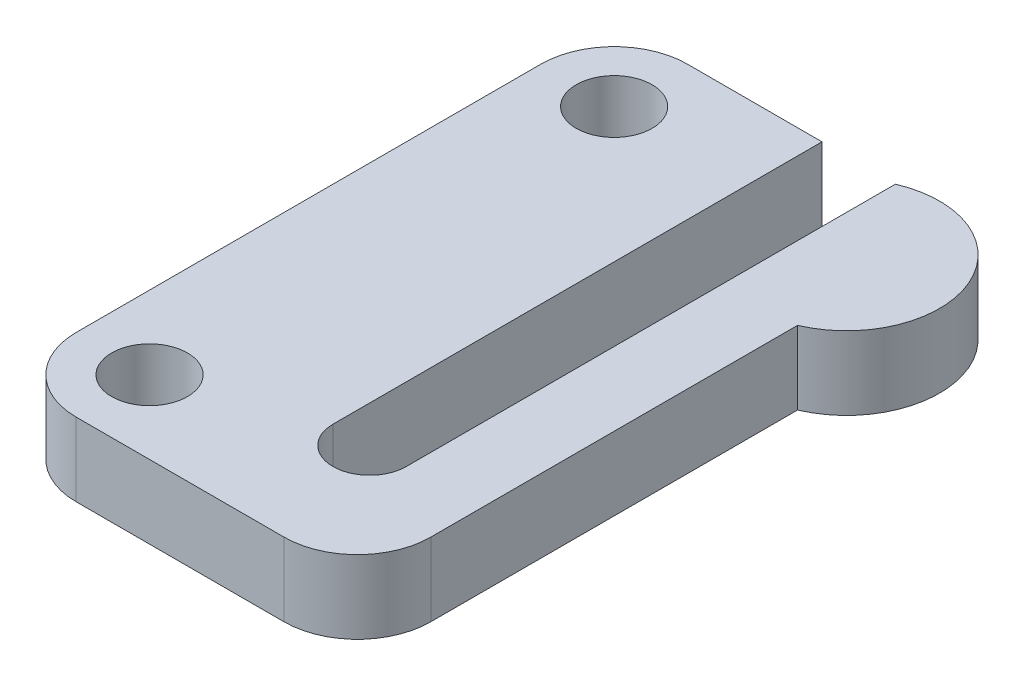
from build123d import *

# Parameters (mm, degrees)
SKETCH1_R           = 1.55
BOSS_EXTRUDE1_DEPTH = 3
FILLET1_R           = 3
FILLET3_R           = 3


with BuildPart() as part:
    # Sketch1 → Boss-Extrude1 (new body)
    with BuildSketch(Plane(origin=(0, 0, 0), x_dir=(1, 0, 0), z_dir=(0, 1, 0))):
        with BuildLine():
            Line((2, -7.5), (2, 5.5))
            ThreePointArc((2, 5.5), (4, 10.5), (-1, 12.5))
            Line((-1, 12.5), (-1, -7.5))
            ThreePointArc((-1, -7.5), (-2.5, -9), (-4, -7.5))
            Line((-4, -7.5), (-4, 12.5))
            Line((-4, 12.5), (-12.5, 12.5))
            Line((-12.5, 12.5), (-12.5, -12.5))
            Line((-12.5, -12.5), (2, -12.5))
            Line((2, -12.5), (2, -7.5))
        make_face()
        with Locations(Location((-9.5, 9.5, 0), (0, 0, 270))):
            Circle(SKETCH1_R, mode=Mode.SUBTRACT)
        with Locations(Location((-9.5, -9.5, 0), (0, 0, 270))):
            Circle(SKETCH1_R, mode=Mode.SUBTRACT)
    extrude(amount=-BOSS_EXTRUDE1_DEPTH)

    # Fillet1
    fillet1_edges = [part.edges().sort_by_distance(p)[0] for p in [
        (2, -1.5, 12.5),
    ]]
    fillet(fillet1_edges, radius=FILLET1_R)

    # Fillet3
    fillet3_edges = [part.edges().sort_by_distance(p)[0] for p in [
        (-12.5, -1.5, 12.5),
        (-12.5, -1.5, -12.5),
    ]]
    fillet(fillet3_edges, radius=FILLET3_R)


solid = part.part
